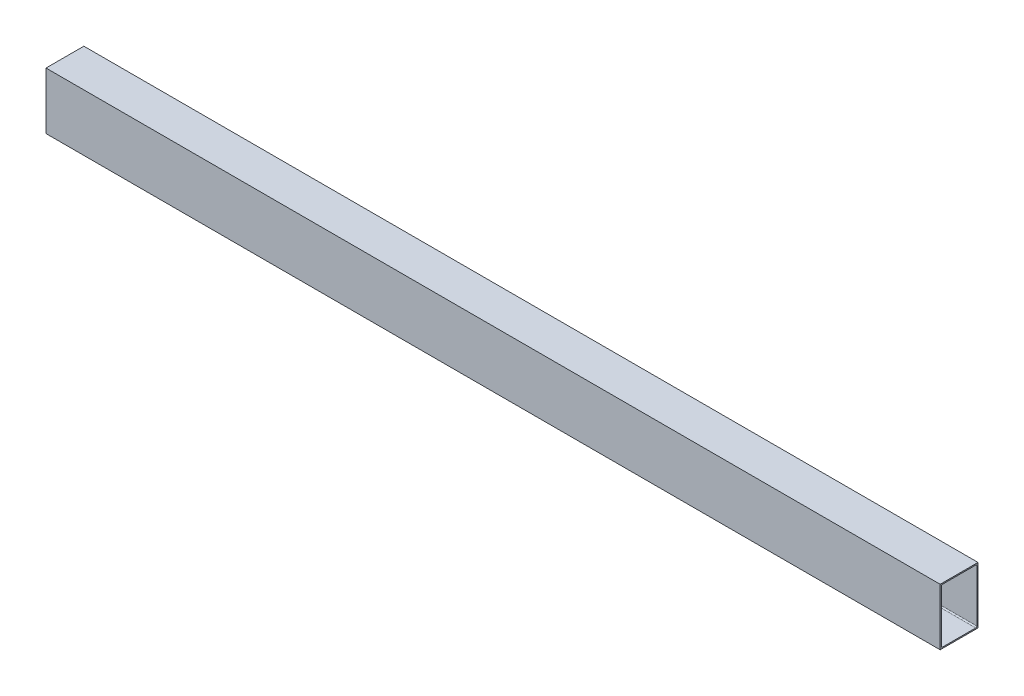
from build123d import *

# Parameters (mm, degrees)
SKETCH1_W           = 101.6
SKETCH1_H           = 152.4
BOSS_EXTRUDE1_DEPTH = 2400


with BuildPart() as part:
    # Sketch1 → Boss-Extrude1 (new body)
    with BuildSketch(Plane(origin=(0, 0, 0), x_dir=(0, 0, -1), z_dir=(1, 0, 0))):
        with Locations((-50.8, 76.2)):
            Rectangle(SKETCH1_W, SKETCH1_H)
        with BuildLine():
            Line((-98.425, 6.35), (-98.425, 146.05))
            ThreePointArc((-98.425, 146.05), (-97.49506403, 148.29506403), (-95.25, 149.225))
            Line((-95.25, 149.225), (-6.35, 149.225))
            ThreePointArc((-6.35, 149.225), (-4.10493597, 148.29506403), (-3.175, 146.05))
            Line((-3.175, 146.05), (-3.175, 6.35))
            ThreePointArc((-3.175, 6.35), (-4.10493597, 4.10493597), (-6.35, 3.175))
            Line((-6.35, 3.175), (-95.25, 3.175))
            ThreePointArc((-95.25, 3.175), (-97.49506403, 4.10493597), (-98.425, 6.35))
        make_face(mode=Mode.SUBTRACT)
    extrude(amount=BOSS_EXTRUDE1_DEPTH)


solid = part.part
